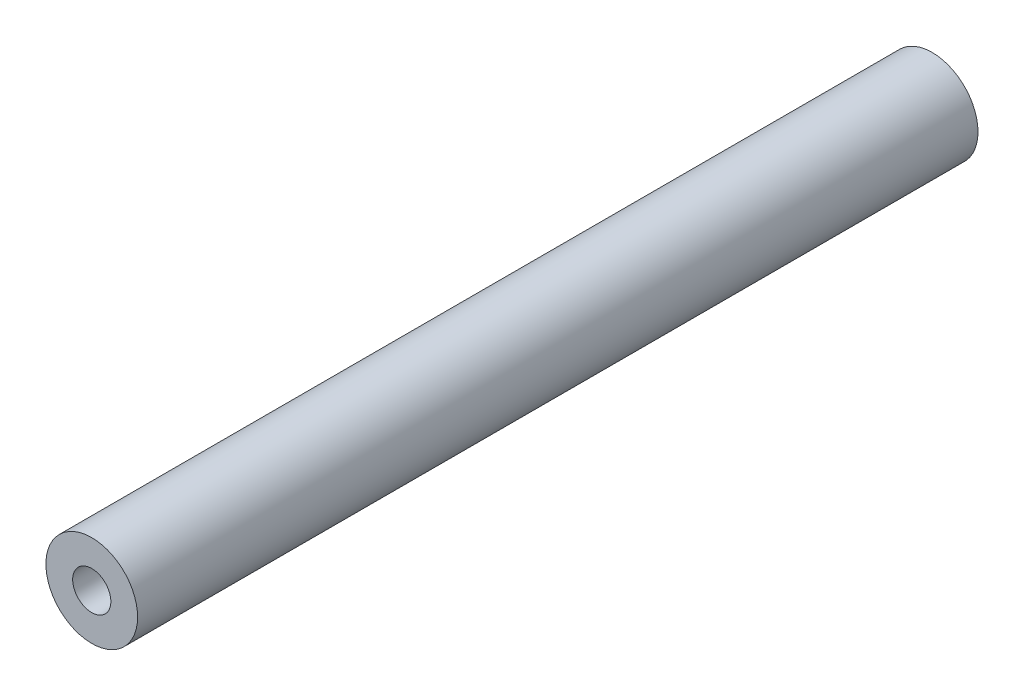
from build123d import *

# Parameters (mm, degrees)
ESBO_O1_R                                   = 3
RESSALTO_EXTRUS_O1_DEPTH                    = 55
BROCA_DE_ROSQUEAR_PARA_TARRAXA_DE_M32_D     = 2.5
BROCA_DE_ROSQUEAR_PARA_TARRAXA_DE_M32_DEPTH = 4
BROCA_DE_ROSQUEAR_PARA_TARRAXA_DE_M32_TIP   = 0.751075774
BROCA_DE_ROSQUEAR_PARA_TARRAXA_DE_M31_D     = 2.5
BROCA_DE_ROSQUEAR_PARA_TARRAXA_DE_M31_DEPTH = 4
BROCA_DE_ROSQUEAR_PARA_TARRAXA_DE_M31_TIP   = 0.751075774


with BuildPart() as part:
    # Esboço1 → Ressalto-extrusão1 (new body)
    with BuildSketch(Plane.XY):
        Circle(ESBO_O1_R)
    extrude(amount=RESSALTO_EXTRUS_O1_DEPTH)

    # Broca de rosquear para tarraxa de M32
    with Locations(Plane.XY.offset(55)):
        with Locations((0, 0)):
            Hole(BROCA_DE_ROSQUEAR_PARA_TARRAXA_DE_M32_D / 2, depth=BROCA_DE_ROSQUEAR_PARA_TARRAXA_DE_M32_DEPTH)
            with Locations((0, 0, -(BROCA_DE_ROSQUEAR_PARA_TARRAXA_DE_M32_DEPTH + BROCA_DE_ROSQUEAR_PARA_TARRAXA_DE_M32_TIP / 2))):  # 118° drill point
                Cone(0, BROCA_DE_ROSQUEAR_PARA_TARRAXA_DE_M32_D / 2, BROCA_DE_ROSQUEAR_PARA_TARRAXA_DE_M32_TIP, mode=Mode.SUBTRACT)

    # Broca de rosquear para tarraxa de M31
    with Locations(Plane(origin=(0, 0, 0), x_dir=(-1, 0, 0), z_dir=(0, 0, -1))):
        with Locations((0, 0)):
            Hole(BROCA_DE_ROSQUEAR_PARA_TARRAXA_DE_M31_D / 2, depth=BROCA_DE_ROSQUEAR_PARA_TARRAXA_DE_M31_DEPTH)
            with Locations((0, 0, -(BROCA_DE_ROSQUEAR_PARA_TARRAXA_DE_M31_DEPTH + BROCA_DE_ROSQUEAR_PARA_TARRAXA_DE_M31_TIP / 2))):  # 118° drill point
                Cone(0, BROCA_DE_ROSQUEAR_PARA_TARRAXA_DE_M31_D / 2, BROCA_DE_ROSQUEAR_PARA_TARRAXA_DE_M31_TIP, mode=Mode.SUBTRACT)


solid = part.part
